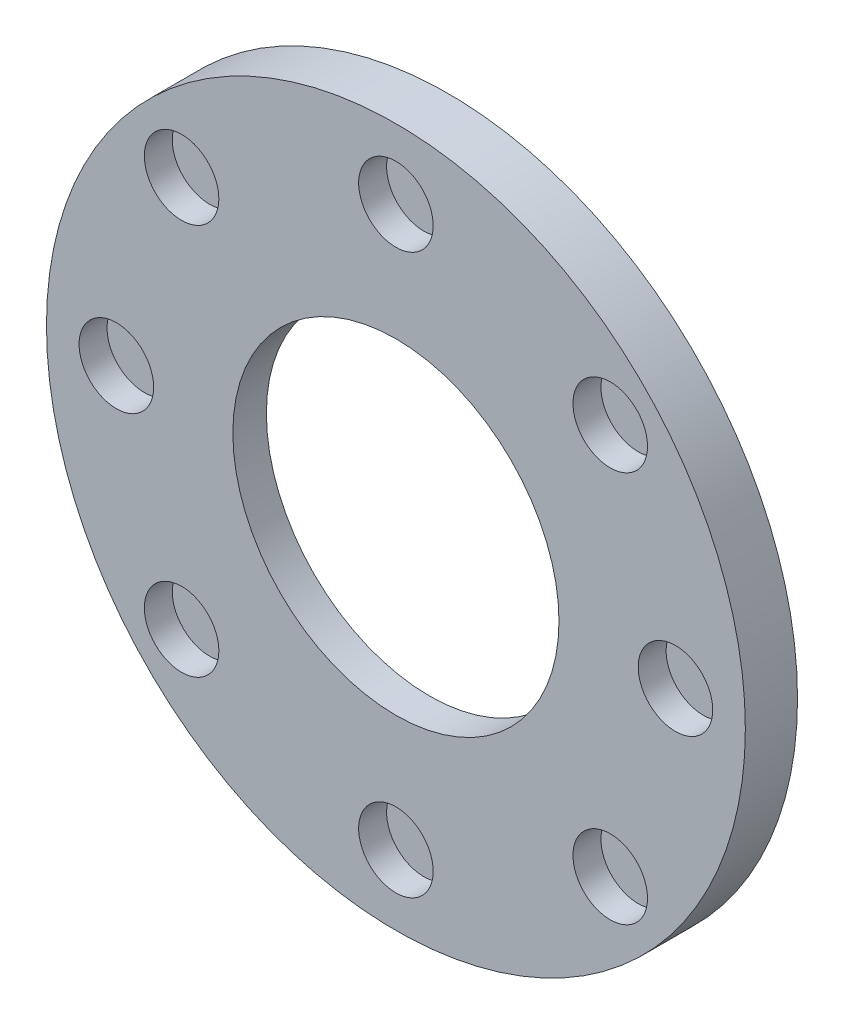
from build123d import *

# Parameters (mm, degrees)
SKETCH_1_R      = 37.5
SKETCH_1_R_2    = 25
EXTRUDE_1_DEPTH = 2
SKETCH_2_R      = 37.5
SKETCH_2_R_2    = 17.5
EXTRUDE_2_DEPTH = 0.6
SKETCH_3_R      = 37.5
SKETCH_3_R_2    = 17.5
SKETCH_3_R_3    = 4
EXTRUDE_3_DEPTH = 3


with BuildPart() as part:
    # Эскиз1 → Бобышка-Вытянуть1 (new body)
    with BuildSketch(Plane.XY):
        Circle(SKETCH_1_R)
        Circle(SKETCH_1_R_2, mode=Mode.SUBTRACT)
    extrude(amount=EXTRUDE_1_DEPTH)

    # Эскиз2 → Бобышка-Вытянуть2 (add)
    with BuildSketch(Plane.XY.offset(2)):
        Circle(SKETCH_2_R)
        Circle(SKETCH_2_R_2, mode=Mode.SUBTRACT)
    extrude(amount=EXTRUDE_2_DEPTH)

    # Эскиз3 → Бобышка-Вытянуть3 (add)
    with BuildSketch(Plane.XY.offset(2.6)):
        Circle(SKETCH_3_R)
        Circle(SKETCH_3_R_2, mode=Mode.SUBTRACT)
        with Locations((0, 30)):
            Circle(SKETCH_3_R_3, mode=Mode.SUBTRACT)
        with Locations((0, -30)):
            Circle(SKETCH_3_R_3, mode=Mode.SUBTRACT)
        with Locations((30, 0)):
            Circle(SKETCH_3_R_3, mode=Mode.SUBTRACT)
        with Locations((-30, 0)):
            Circle(SKETCH_3_R_3, mode=Mode.SUBTRACT)
        with Locations((23, 21)):
            Circle(SKETCH_3_R_3, mode=Mode.SUBTRACT)
        with Locations((-23, 21)):
            Circle(SKETCH_3_R_3, mode=Mode.SUBTRACT)
        with Locations((-23, -21)):
            Circle(SKETCH_3_R_3, mode=Mode.SUBTRACT)
        with Locations((23, -21)):
            Circle(SKETCH_3_R_3, mode=Mode.SUBTRACT)
    extrude(amount=EXTRUDE_3_DEPTH)


solid = part.part
